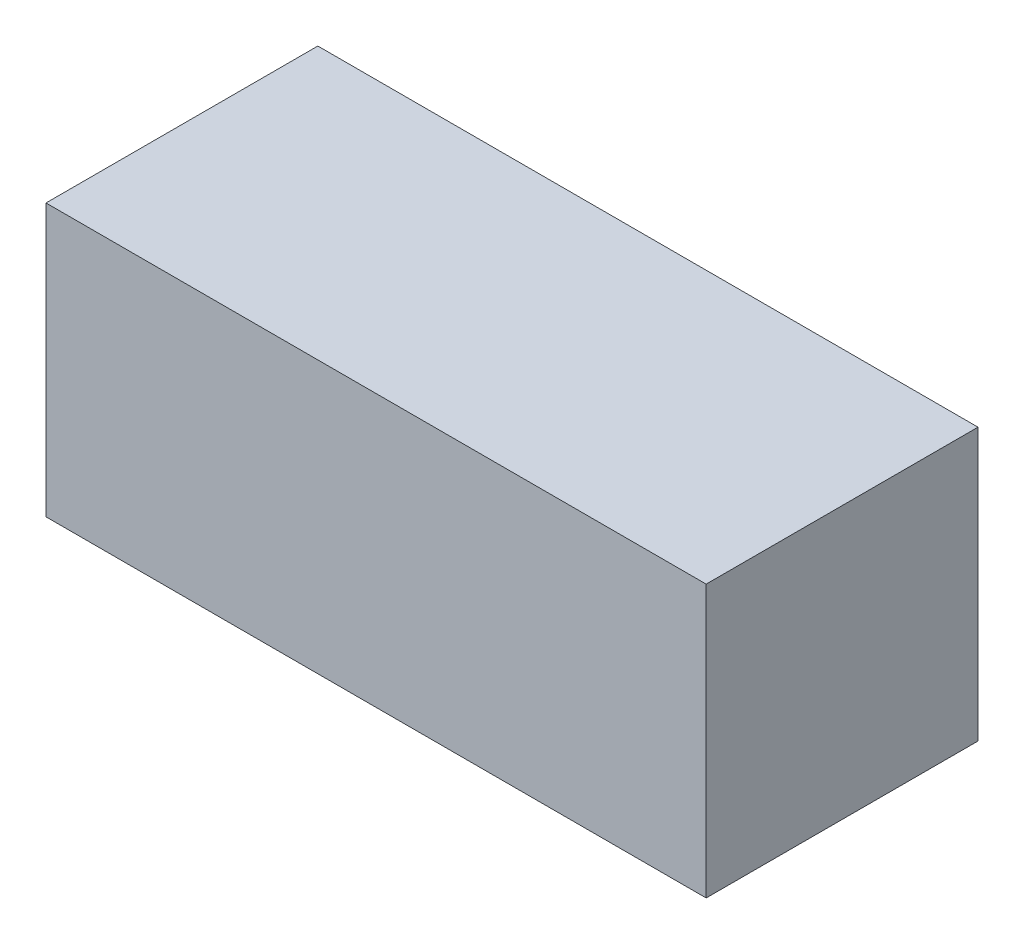
from build123d import *

# Parameters (mm, degrees)
SKETCH1_W           = 170
SKETCH1_H           = 70
BOSS_EXTRUDE1_DEPTH = 70


with BuildPart() as part:
    # Sketch1 → Boss-Extrude1 (new body)
    with BuildSketch(Plane(origin=(0, 0, 0), x_dir=(1, 0, 0), z_dir=(0, 1, 0))):
        Rectangle(SKETCH1_W, SKETCH1_H)
    extrude(amount=BOSS_EXTRUDE1_DEPTH)


solid = part.part
